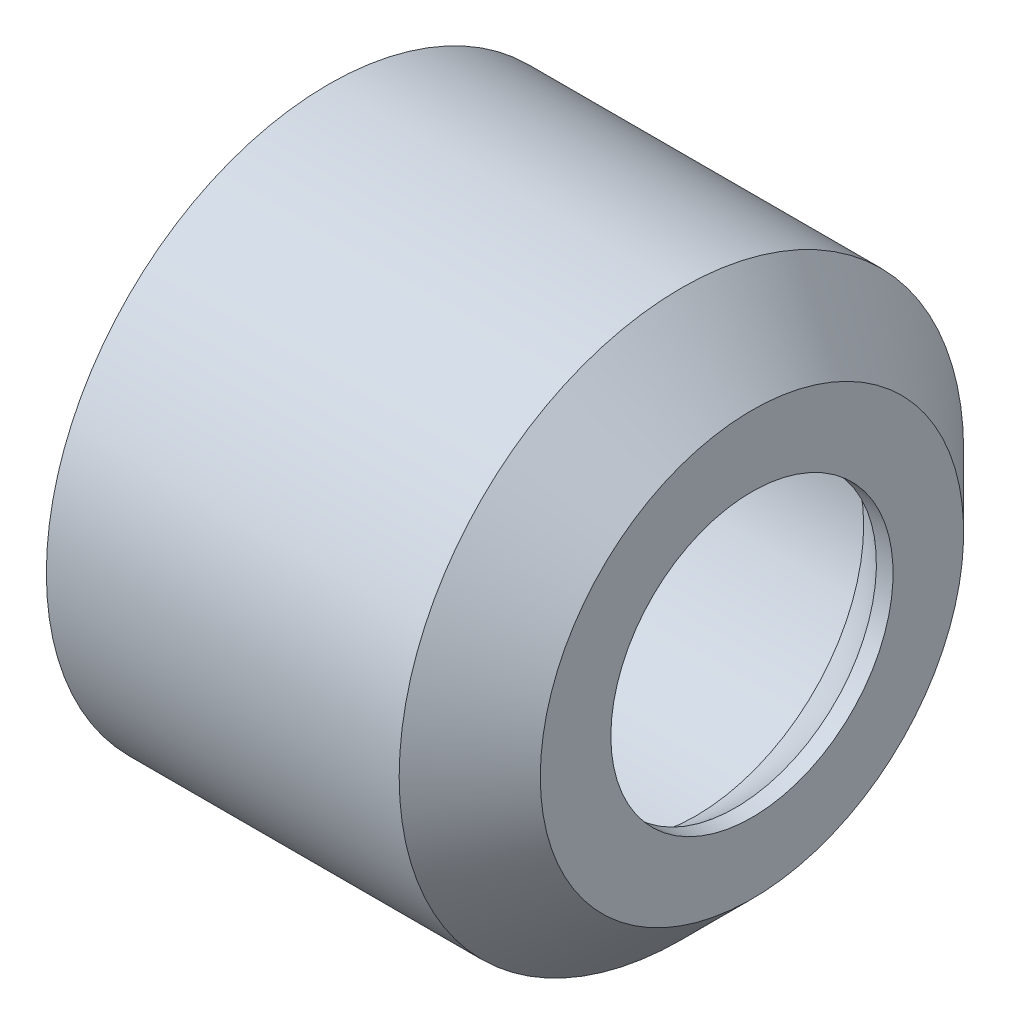
from build123d import *


with BuildPart() as part:
    # 草图1 → 旋转1 (revolve)
    with BuildSketch(Plane.XY, mode=Mode.PRIVATE) as revolve_1_sk:
        with BuildLine():
            Line((32.73725094, 12), (35.73725094, 9))
            Line((35.73725094, 9), (35.73725094, 6))
            Line((35.73725094, 6), (35.028753562, 6))
            ThreePointArc((35.028753562, 6), (34.224082532, 6.623318071), (33.346779451, 7.139419019))
            Line((33.346779451, 7.139419019), (33.346779451, 9))
            Line((33.346779451, 9), (17.73725094, 9))
            Line((17.73725094, 9), (17.73725094, 12))
            Line((17.73725094, 12), (32.73725094, 12))
        make_face()
    revolve(revolve_1_sk.sketch.rotate(Axis((0, 0, 0), (1, 0, 0)), 90), axis=Axis((0, 0, 0), (1, 0, 0)))


solid = part.part
